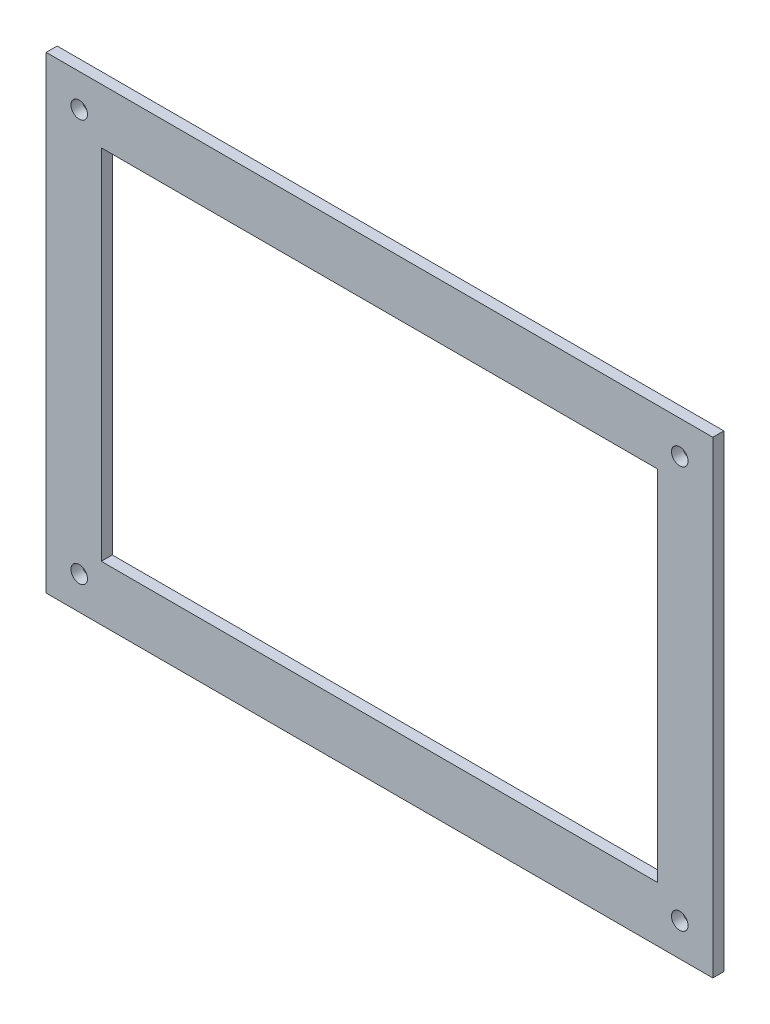
from build123d import *

# Parameters (mm, degrees)
SKETCH1_W           = 121
SKETCH1_H           = 85
BOSS_EXTRUDE1_DEPTH = 2
SKETCH4_W           = 101
SKETCH4_H           = 65
CUT_EXTRUDE1_DEPTH  = 148.885090526
SKETCH5_R           = 1.5
CUT_EXTRUDE2_DEPTH  = 148.885090526


with BuildPart() as part:
    # Sketch1 → Boss-Extrude1 (new body)
    with BuildSketch(Plane.XY):
        with Locations((60.5, 42.5)):
            Rectangle(SKETCH1_W, SKETCH1_H)
    extrude(amount=BOSS_EXTRUDE1_DEPTH)

    # Sketch4 → Cut-Extrude1 (cut, through all)
    with BuildSketch(Plane.XY.offset(2)):
        with Locations((60.5, 42.5)):
            Rectangle(SKETCH4_W, SKETCH4_H)
    extrude(amount=-CUT_EXTRUDE1_DEPTH, mode=Mode.SUBTRACT)

    # Sketch5 → Cut-Extrude2 (cut, through all)
    with BuildSketch(Plane.XY.offset(2)):
        with Locations((6, 79)):
            Circle(SKETCH5_R)
        with Locations((115, 79)):
            Circle(SKETCH5_R)
        with Locations((6, 6)):
            Circle(SKETCH5_R)
        with Locations((115, 6)):
            Circle(SKETCH5_R)
    extrude(amount=-CUT_EXTRUDE2_DEPTH, mode=Mode.SUBTRACT)


solid = part.part
